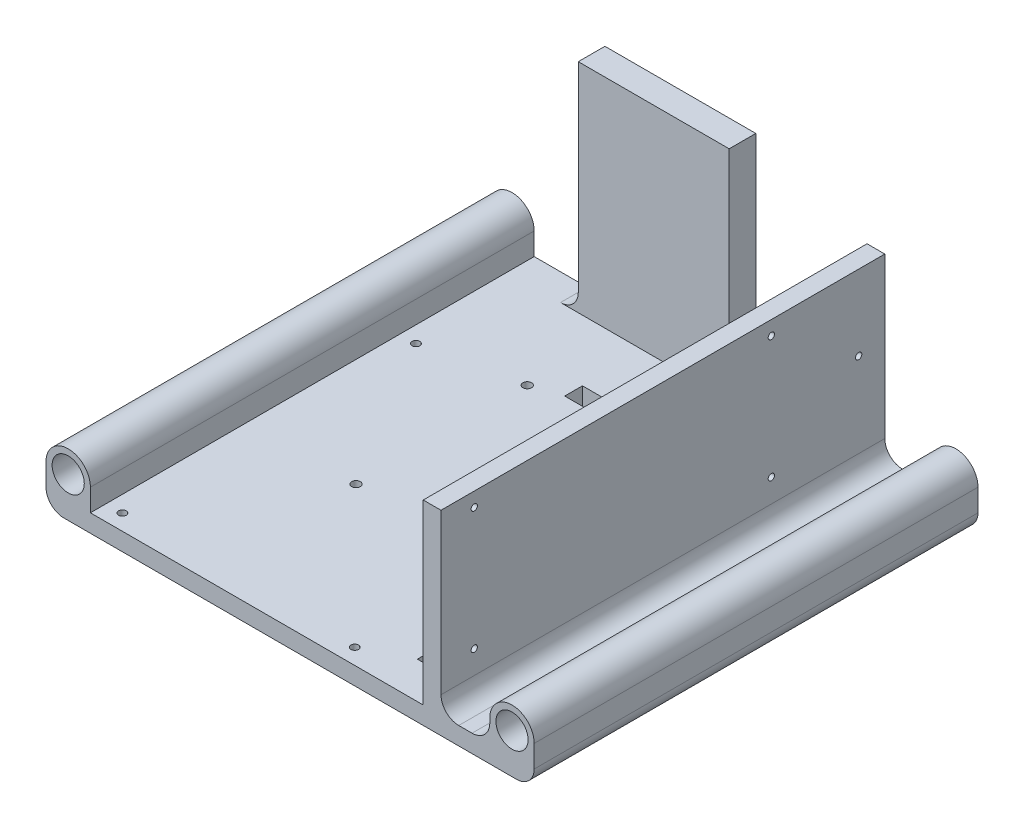
from build123d import *

# Parameters (mm, degrees)
SKETCH1_R           = 4.60375
BOSS_EXTRUDE1_DEPTH = 127
SKETCH3_R           = 1.249999967
CUT_EXTRUDE3_DEPTH  = 190.290136172
SKETCH4_R           = 1.1
CUT_EXTRUDE4_DEPTH  = 189.880695817
SKETCH5_W           = 5.08
SKETCH5_H           = 127
BOSS_EXTRUDE2_DEPTH = 50.8
SKETCH6_R           = 0.899999978
CUT_EXTRUDE5_DEPTH  = 5.08
SKETCH7_W           = 6.432611175
SKETCH7_H           = 24.280435839
SKETCH7_W_2         = 25.4
SKETCH7_H_2         = 5.08
SKETCH7_W_3         = 7.534248642
SKETCH7_H_3         = 19.188789511
CUT_EXTRUDE6_DEPTH  = 196.180089282
FILLET1_R           = 5.08
SKETCH8_W           = 43.18
SKETCH8_H           = 7.62
BOSS_EXTRUDE3_DEPTH = 62.23
FILLET2_R           = 5.08


with BuildPart() as part:
    # Sketch1 → Boss-Extrude1 (new body)
    with BuildSketch(Plane.XY):
        with BuildLine():
            Line((-0.467721946, 0.970453027), (-0.467721946, -10.459546973))
            Line((-0.467721946, -10.459546973), (139.232278054, -10.459546973))
            Line((139.232278054, -10.459546973), (139.232278054, 0.970453027))
            ThreePointArc((139.232278054, 0.970453027), (132.882278054, 7.320453027), (126.532278054, 0.970453027))
            Line((126.532278054, 0.970453027), (126.532278054, -5.379546973))
            Line((126.532278054, -5.379546973), (12.232278054, -5.379546973))
            Line((12.232278054, -5.379546973), (12.232278054, 0.970453027))
            ThreePointArc((12.232278054, 0.970453027), (5.882278054, 7.320453027), (-0.467721946, 0.970453027))
        make_face()
        with Locations((5.882278054, 0.970453027)):
            Circle(SKETCH1_R, mode=Mode.SUBTRACT)
        with Locations((132.882278054, 0.970453027)):
            Circle(SKETCH1_R, mode=Mode.SUBTRACT)
    extrude(amount=BOSS_EXTRUDE1_DEPTH)

    # Sketch3 → Cut-Extrude3 (cut, through all)
    with BuildSketch(Plane.XZ.offset(10.459546973)):
        with Locations(Location((101.132278054, 81.883033078, 0), (0, 0, 270))):
            Circle(SKETCH3_R)
        with Locations(Location((43.132278054, 81.883033078, 0), (0, 0, 270))):
            Circle(SKETCH3_R)
        with Locations(Location((43.132278054, 32.883033078, 0), (0, 0, 270))):
            Circle(SKETCH3_R)
        with Locations(Location((101.132278054, 32.883033078, 0), (0, 0, 270))):
            Circle(SKETCH3_R)
    extrude(amount=-CUT_EXTRUDE3_DEPTH, mode=Mode.SUBTRACT)

    # Sketch4 → Cut-Extrude4 (cut, through all)
    with BuildSketch(Plane(origin=(0, -5.379546973, 0), x_dir=(1, 0, 0), z_dir=(0, 1, 0))):
        with Locations(Location((16.877982827, -38.47904026, 0), (0, 0, 270))):
            Circle(SKETCH4_R)
        with Locations(Location((16.877982827, -122.479040154, 0), (0, 0, 270))):
            Circle(SKETCH4_R)
        with Locations(Location((83.377982923, -38.47904026, 0), (0, 0, 270))):
            Circle(SKETCH4_R)
        with Locations(Location((83.377982923, -122.479040154, 0), (0, 0, 270))):
            Circle(SKETCH4_R)
    extrude(amount=-CUT_EXTRUDE4_DEPTH, mode=Mode.SUBTRACT)

    # Sketch5 → Boss-Extrude2 (add)
    with BuildSketch(Plane(origin=(0, -5.379546973, 0), x_dir=(1, 0, 0), z_dir=(0, 1, 0))):
        with Locations((110.022278054, -63.5)):
            Rectangle(SKETCH5_W, SKETCH5_H)
    extrude(amount=BOSS_EXTRUDE2_DEPTH)

    # Sketch6 → Cut-Extrude5 (cut)
    with BuildSketch(Plane.ZY.offset(-107.482278054)):
        with Locations((32.475000074, 6.356452923)):
            Circle(SKETCH6_R)
        with Locations((32.475000074, 41.356453027)):
            Circle(SKETCH6_R)
        with Locations((117.475, 6.356452923)):
            Circle(SKETCH6_R)
        with Locations((117.475, 41.356453027)):
            Circle(SKETCH6_R)
        with Locations((7.475000036, 23.856452975)):
            Circle(SKETCH6_R)
    extrude(amount=-CUT_EXTRUDE5_DEPTH, mode=Mode.SUBTRACT)

    # Sketch7 → Cut-Extrude6 (cut, through all)
    with BuildSketch(Plane(origin=(0, -5.379546973, 0), x_dir=(1, 0, 0), z_dir=(0, 1, 0))):
        with Locations((104.265972467, -17.22021792)):
            Rectangle(SKETCH7_W, SKETCH7_H)
        with Locations((63.863358791, -27.662420978)):
            Rectangle(SKETCH7_W_2, SKETCH7_H_2)
        with Locations((99.048382084, -106.880791012)):
            Rectangle(SKETCH7_W_3, SKETCH7_H_3)
    extrude(amount=-CUT_EXTRUDE6_DEPTH, mode=Mode.SUBTRACT)

    # Fillet1
    fillet1_edges = [part.edges().sort_by_distance(p)[0] for p in [
        (126.532278054, -5.379546973, 63.5),
        (139.232278054, -10.459546973, 63.5),
        (-0.467721946, -10.459546973, 63.5),
        (112.562278054, -5.379546973, 63.5),
    ]]
    fillet(fillet1_edges, radius=FILLET1_R)

    # Sketch8 → Boss-Extrude3 (add)
    with BuildSketch(Plane(origin=(0, -5.379546973, 0), x_dir=(1, 0, 0), z_dir=(0, 1, 0))):
        with Locations((54.059666879, -3.81)):
            Rectangle(SKETCH8_W, SKETCH8_H)
    extrude(amount=BOSS_EXTRUDE3_DEPTH)

    # Fillet2
    fillet2_edges = [part.edges().sort_by_distance(p)[0] for p in [
        (32.469666879, -5.379546973, 3.81),
        (75.649666879, -5.379546973, 3.81),
    ]]
    fillet(fillet2_edges, radius=FILLET2_R)


solid = part.part
